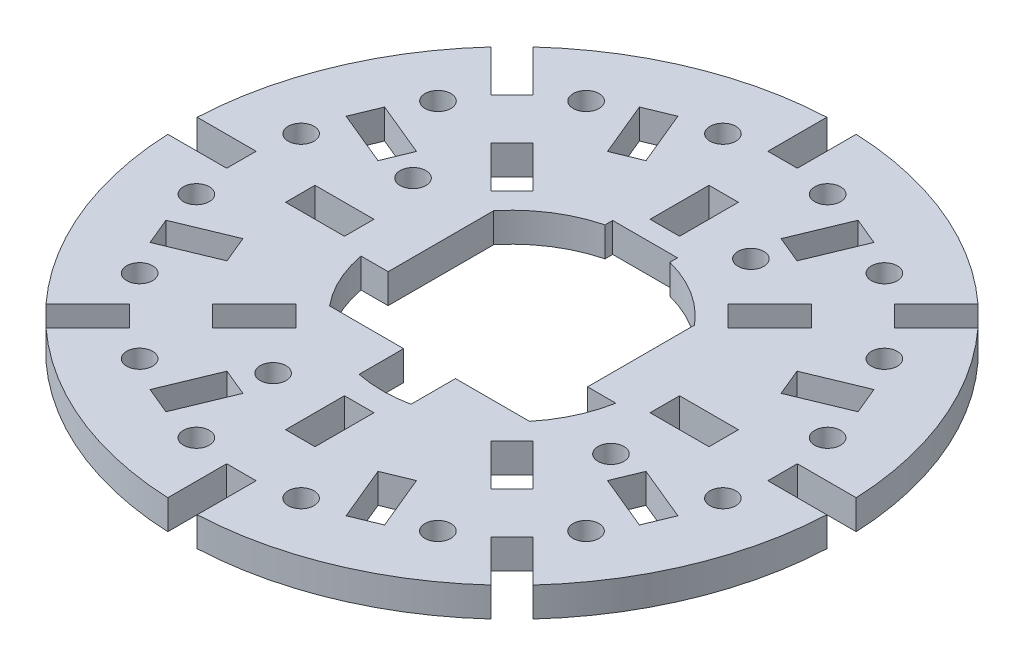
from build123d import *

# Parameters (mm, degrees)
SKETCH1_R           = 35.56
BOSS_EXTRUDE1_DEPTH = 1.5875
SKETCH2_W           = 1.5875
SKETCH2_H           = 6.35
CUT_EXTRUDE1_DEPTH  = 51.389560675
CIRPATTERN1_COUNT   = 8
BOSS_EXTRUDE2_DEPTH = 3.175
SKETCH4_R           = 1.397
CUT_EXTRUDE2_DEPTH  = 3.175
CIRPATTERN2_COUNT   = 4
CUT_EXTRUDE3_DEPTH  = 51.339522371
CIRPATTERN3_COUNT   = 8
SKETCH6_R           = 1.397
CUT_EXTRUDE4_DEPTH  = 51.339522371
CIRPATTERN4_COUNT   = 16


with BuildPart() as part:
    # Sketch1 → Boss-Extrude1 (new, symmetric)
    with BuildSketch(Plane(origin=(0, 0, 0), x_dir=(1, 0, 0), z_dir=(0, 1, 0))):
        with Locations(Location((0, 0, 0), (0, 0, 270))):
            Circle(SKETCH1_R)
        with BuildLine():
            ThreePointArc((-13.969422727, 0.126998688), (-11.005254984, 8.604955708), (-3.4925, 13.526394337))
            Line((-3.4925, 13.526394337), (-3.4925, 14.351))
            Line((-3.4925, 14.351), (3.4925, 14.351))
            Line((3.4925, 14.351), (3.4925, 13.526394337))
            ThreePointArc((3.4925, 13.526394337), (11.044254728, 8.554842927), (13.97, 0))
            ThreePointArc((13.97, 0), (0.0635, -13.969855681), (-13.969422727, -0.126998688))
            ThreePointArc((-13.969422727, -0.126998688), (-14.097, 0), (-13.969422727, 0.126998688))
        make_face(mode=Mode.SUBTRACT)
    extrude(amount=BOSS_EXTRUDE1_DEPTH, both=True)

    # Sketch2 → Cut-Extrude1 (cut, through all)
    with BuildSketch(Plane(origin=(0, 1.5875, 0), x_dir=(1, 0, 0), z_dir=(0, 1, 0))):
        with BuildLine():
            ThreePointArc((1.5875, 35.524547059), (0.793947914, 35.55113566), (0, 35.56))
            Line((0, 35.56), (0, 29.174547059))
            Line((0, 29.174547059), (1.5875, 29.174547059))
            Line((1.5875, 29.174547059), (1.5875, 35.524547059))
        make_face()
        with BuildLine():
            Line((0, 29.174547059), (0, 35.56))
            ThreePointArc((0, 35.56), (-0.793947914, 35.55113566), (-1.5875, 35.524547059))
            Line((-1.5875, 35.524547059), (-1.5875, 29.174547059))
            Line((-1.5875, 29.174547059), (0, 29.174547059))
        make_face()
        with Locations((-0.79375, 19.649547059)):
            Rectangle(SKETCH2_W, SKETCH2_H)
        with Locations((0.79375, 19.649547059)):
            Rectangle(SKETCH2_W, SKETCH2_H)
    cut_extrude1 = extrude(amount=-CUT_EXTRUDE1_DEPTH, mode=Mode.SUBTRACT)

    # CirPattern1: Cut-Extrude1 ×8 about axis
    cirpattern1_axis = Axis((0, 0, 0), (0, 1, 0))
    for i in range(1, CIRPATTERN1_COUNT):
        add(cut_extrude1.rotate(cirpattern1_axis, i * 360 / CIRPATTERN1_COUNT), mode=Mode.SUBTRACT)

    # Sketch3 → Boss-Extrude2 (add)
    with BuildSketch(Plane(origin=(0, 1.5875, 0), x_dir=(1, 0, 0), z_dir=(0, 1, 0))):
        with BuildLine():
            ThreePointArc((-13.969422727, -0.126998688), (-13.905725148, -1.338547016), (-13.73715036, -2.54))
            Line((-13.73715036, -2.54), (-10.81615036, -2.54))
            Line((-10.81615036, -2.54), (-10.81615036, 8.84148129))
            ThreePointArc((-10.81615036, 8.84148129), (-13.1364649, 4.753334612), (-13.969422727, 0.126998688))
            ThreePointArc((-13.969422727, 0.126998688), (-14.097, 0), (-13.969422727, -0.126998688))
        make_face()
        with BuildLine():
            Line((10.68915036, -2.54), (13.73715036, -2.54))
            ThreePointArc((13.73715036, -2.54), (13.506399758, 3.569042671), (10.68915036, 8.994607528))
            Line((10.68915036, 8.994607528), (10.68915036, -2.54))
        make_face()
        with BuildLine():
            Line((2.794, -8.89), (2.794, -13.687748683))
            ThreePointArc((2.794, -13.687748683), (7.196729012, -11.973637356), (10.776307345, -8.89))
            Line((10.776307345, -8.89), (2.794, -8.89))
        make_face()
        with BuildLine():
            Line((-2.794, -8.89), (-10.776307345, -8.89))
            ThreePointArc((-10.776307345, -8.89), (-7.196729012, -11.973637356), (-2.794, -13.687748683))
            Line((-2.794, -13.687748683), (-2.794, -8.89))
        make_face()
    extrude(amount=-BOSS_EXTRUDE2_DEPTH)

    # Sketch4 → Cut-Extrude2 (cut)
    with BuildSketch(Plane(origin=(0, 1.5875, 0), x_dir=(1, 0, 0), z_dir=(0, 1, 0))):
        with Locations(Location((7.544056765, 18.212964157, 0), (0, 0, 270))):
            Circle(SKETCH4_R)
    cut_extrude2 = extrude(amount=-CUT_EXTRUDE2_DEPTH, mode=Mode.SUBTRACT)

    # CirPattern2: Cut-Extrude2 ×4 about axis
    cirpattern2_axis = Axis((0, 0, 0), (0, 1, 0))
    for i in range(1, CIRPATTERN2_COUNT):
        add(cut_extrude2.rotate(cirpattern2_axis, i * 360 / CIRPATTERN2_COUNT), mode=Mode.SUBTRACT)

    # Sketch5 → Cut-Extrude3 (cut, through all)
    with BuildSketch(Plane(origin=(0, 1.5875, 0), x_dir=(1, 0, 0), z_dir=(0, 1, 0))):
        Polygon((-26.379011196, 12.644841817), (-27.594031094, 9.711524302), (-21.727396062, 7.281484506), (-20.512376164, 10.214802022), align=None)
    cut_extrude3 = extrude(amount=-CUT_EXTRUDE3_DEPTH, mode=Mode.SUBTRACT)

    # CirPattern3: Cut-Extrude3 ×8 about axis
    cirpattern3_axis = Axis((0, 0, 0), (0, 1, 0))
    for i in range(1, CIRPATTERN3_COUNT):
        add(cut_extrude3.rotate(cirpattern3_axis, i * 360 / CIRPATTERN3_COUNT), mode=Mode.SUBTRACT)

    # Sketch6 → Cut-Extrude4 (cut, through all)
    with BuildSketch(Plane(origin=(0, 1.5875, 0), x_dir=(1, 0, 0), z_dir=(0, 1, 0))):
        with Locations(Location((-16.075914933, 24.065531637, 0), (0, 0, 270))):
            Circle(SKETCH6_R)
    cut_extrude4 = extrude(amount=-CUT_EXTRUDE4_DEPTH, mode=Mode.SUBTRACT)

    # CirPattern4: Cut-Extrude4 ×16 about axis
    cirpattern4_axis = Axis((0, 0, 0), (0, 1, 0))
    for i in range(1, CIRPATTERN4_COUNT):
        add(cut_extrude4.rotate(cirpattern4_axis, i * 360 / CIRPATTERN4_COUNT), mode=Mode.SUBTRACT)


solid = part.part
